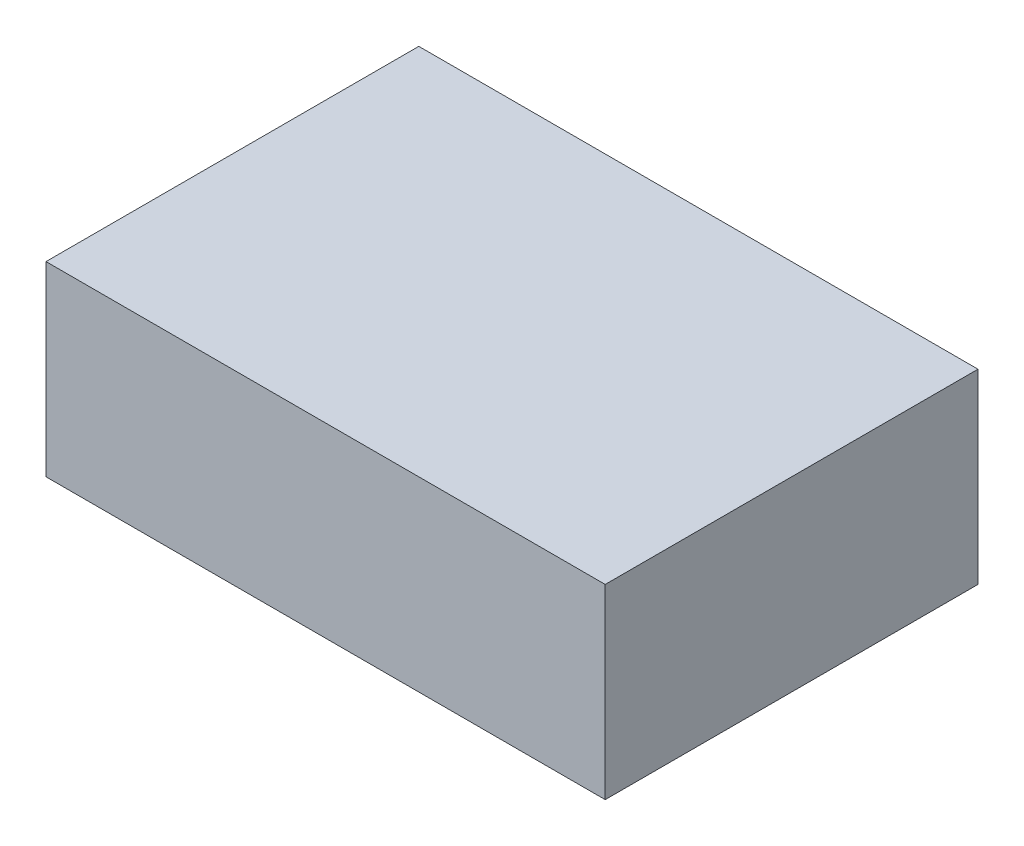
from build123d import *

# Parameters (mm, degrees)
SKETCH_1_W      = 60
SKETCH_1_H      = 40
EXTRUDE_1_DEPTH = 20


with BuildPart() as part:
    # Эскиз1 → Бобышка-Вытянуть1 (new body)
    with BuildSketch(Plane(origin=(0, 0, 0), x_dir=(1, 0, 0), z_dir=(0, 1, 0))):
        Rectangle(SKETCH_1_W, SKETCH_1_H)
    extrude(amount=EXTRUDE_1_DEPTH)


solid = part.part
